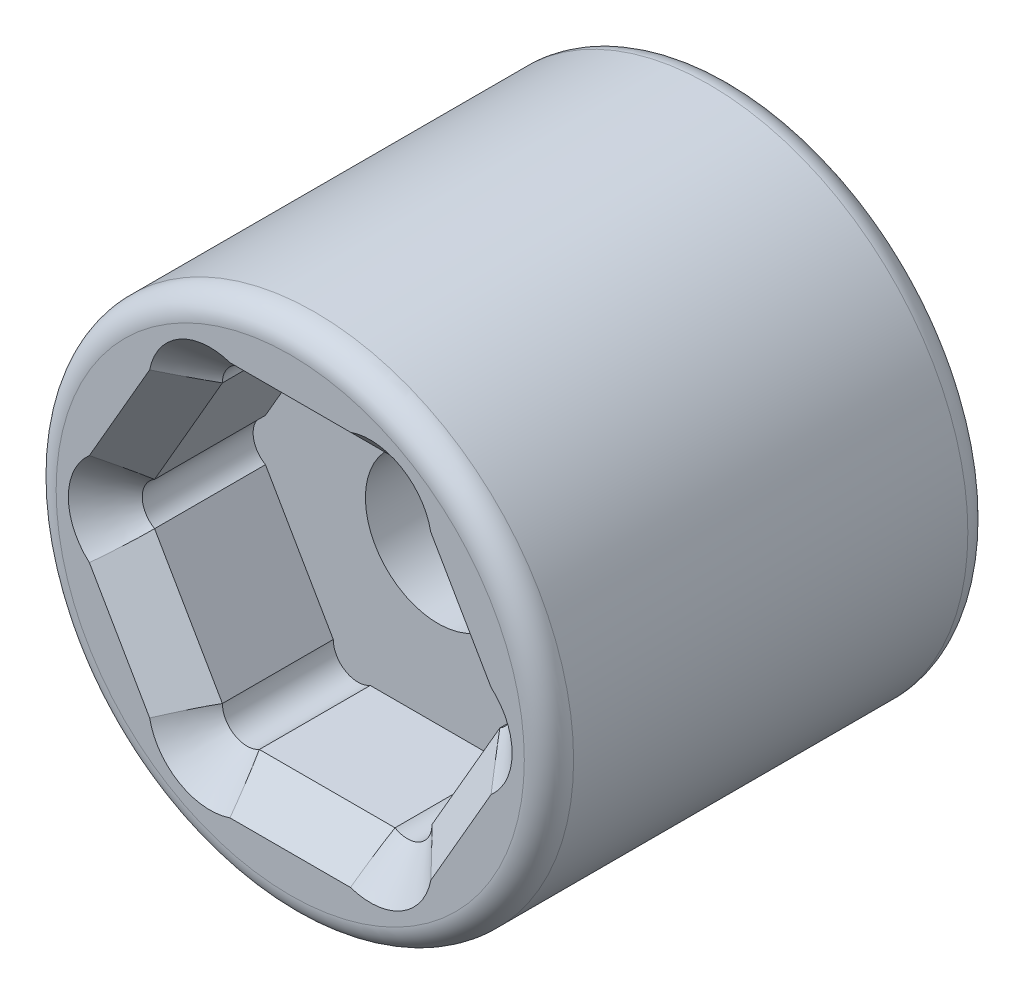
from build123d import *

# Parameters (mm, degrees)
SKETCH1_R           = 10.5
BOSS_EXTRUDE1_DEPTH = 6
BOSS_EXTRUDE2_START = 12
SKETCH2_R           = 10.5
SKETCH2_R_2         = 2.95
BOSS_EXTRUDE2_DEPTH = 12
CHAMFER1_SIZE       = 1.5
FILLET1_R           = 1


with BuildPart() as part:
    # Sketch1 → Boss-Extrude1 (new body)
    with BuildSketch(Plane.XY):
        Circle(SKETCH1_R)
        with BuildLine():
            Line((-2.75277675, 6.5), (2.75277675, 6.5))
            ThreePointArc((2.75277675, 6.5), (3.75277675, 6.5), (4.25277675, 5.633974596))
            Line((4.25277675, 5.633974596), (7.005553499, 0.866025404))
            ThreePointArc((7.005553499, 0.866025404), (7.505553499, 0), (7.005553499, -0.866025404))
            Line((7.005553499, -0.866025404), (4.25277675, -5.633974596))
            ThreePointArc((4.25277675, -5.633974596), (3.75277675, -6.5), (2.75277675, -6.5))
            Line((2.75277675, -6.5), (-2.75277675, -6.5))
            ThreePointArc((-2.75277675, -6.5), (-3.75277675, -6.5), (-4.25277675, -5.633974596))
            Line((-4.25277675, -5.633974596), (-7.005553499, -0.866025404))
            ThreePointArc((-7.005553499, -0.866025404), (-7.505553499, 0), (-7.005553499, 0.866025404))
            Line((-7.005553499, 0.866025404), (-4.25277675, 5.633974596))
            ThreePointArc((-4.25277675, 5.633974596), (-3.75277675, 6.5), (-2.75277675, 6.5))
        make_face(mode=Mode.SUBTRACT)
    extrude(amount=BOSS_EXTRUDE1_DEPTH)

    # Sketch2 → Boss-Extrude2 (add)
    with BuildSketch(Plane(origin=(0, 0, 0), x_dir=(-1, 0, 0), z_dir=(0, 0, -1)).offset(BOSS_EXTRUDE2_START)):
        Circle(SKETCH2_R)
        Circle(SKETCH2_R_2, mode=Mode.SUBTRACT)
    extrude(amount=-BOSS_EXTRUDE2_DEPTH)

    # Chamfer1
    chamfer1_edges = [part.edges().sort_by_distance(p)[0] for p in [
        (-3.75277675, 6.5, 6),
        (-5.629165125, 3.25, 6),
        (-7.505553499, 0, 6),
        (-5.629165125, -3.25, 6),
        (-3.75277675, -6.5, 6),
        (0, -6.5, 6),
        (3.75277675, -6.5, 6),
        (5.629165125, -3.25, 6),
        (7.505553499, 0, 6),
        (5.629165125, 3.25, 6),
        (3.75277675, 6.5, 6),
        (0, 6.5, 6),
        (2.95, 0, -12),
    ]]
    chamfer(chamfer1_edges, length=CHAMFER1_SIZE)

    # Fillet1
    fillet1_edges = [part.edges().sort_by_distance(p)[0] for p in [
        (-10.5, 0, 6),
        (10.5, 0, -12),
    ]]
    fillet(fillet1_edges, radius=FILLET1_R)


solid = part.part
